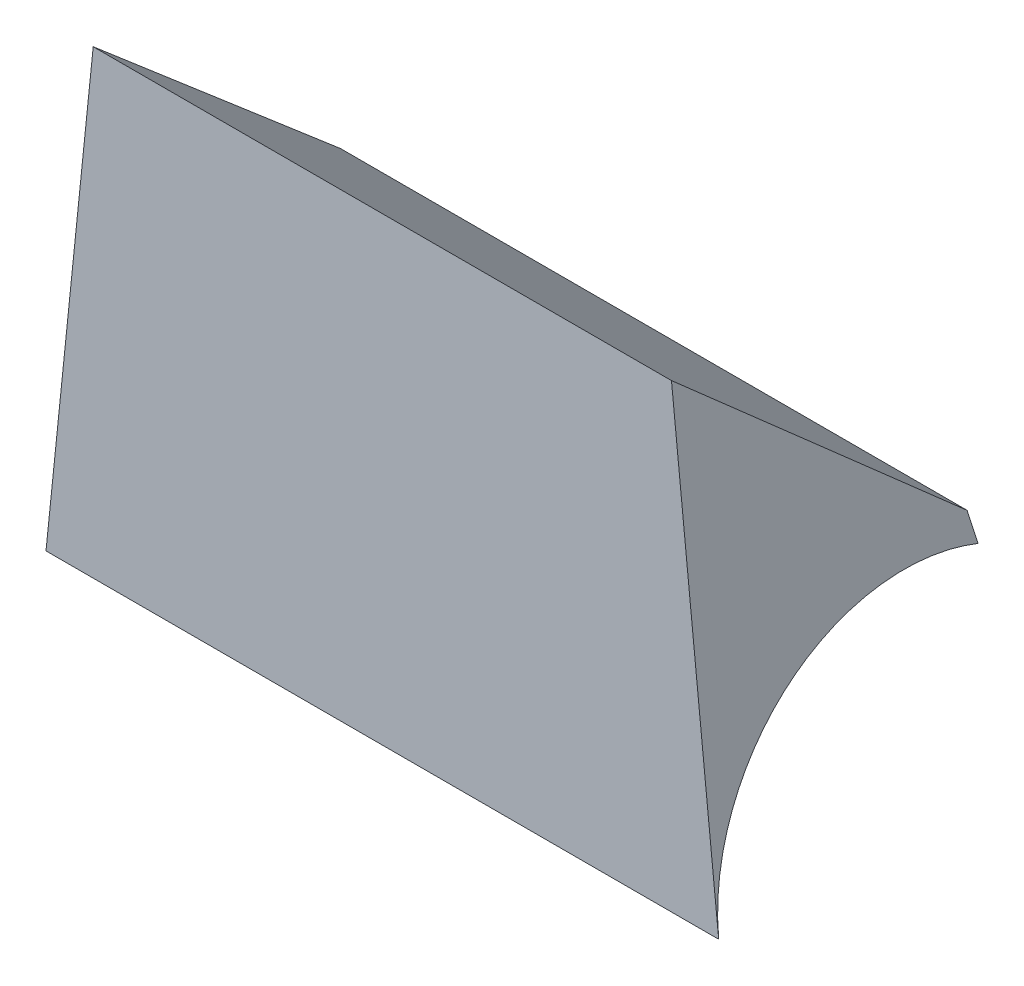
from build123d import *

# Parameters (mm, degrees)
EXTRUDE_1_DEPTH     = 57
CUT_EXTRUDE_1_DEPTH = 74.003602791


with BuildPart() as part:
    # Эскиз1 → Бобышка-Вытянуть1 (new body)
    with BuildSketch(Plane(origin=(0, 0, 0), x_dir=(0, 0, -1), z_dir=(1, 0, 0))):
        with BuildLine():
            Line((0, 0), (0, -39))
            ThreePointArc((0, -39), (7.536323255, -24.613369202), (23.654302368, -22.617858432))
            Line((23.654302368, -22.617858432), (23, -19.99359497))
            Line((23, -19.99359497), (0, 0))
        make_face()
    extrude(amount=EXTRUDE_1_DEPTH)

    # Эскиз2 → Вырез-Вытянуть1 (cut, through all)
    with BuildSketch(Plane.XY):
        Polygon((67.996620704, 0), (53, 0), (57, -39), (67.996620704, -39), align=None)
        Polygon((0, -39), (-10.996620704, -39), (-10.996620704, 0), (4, 0), align=None)
    extrude(amount=-CUT_EXTRUDE_1_DEPTH, mode=Mode.SUBTRACT)


solid = part.part
